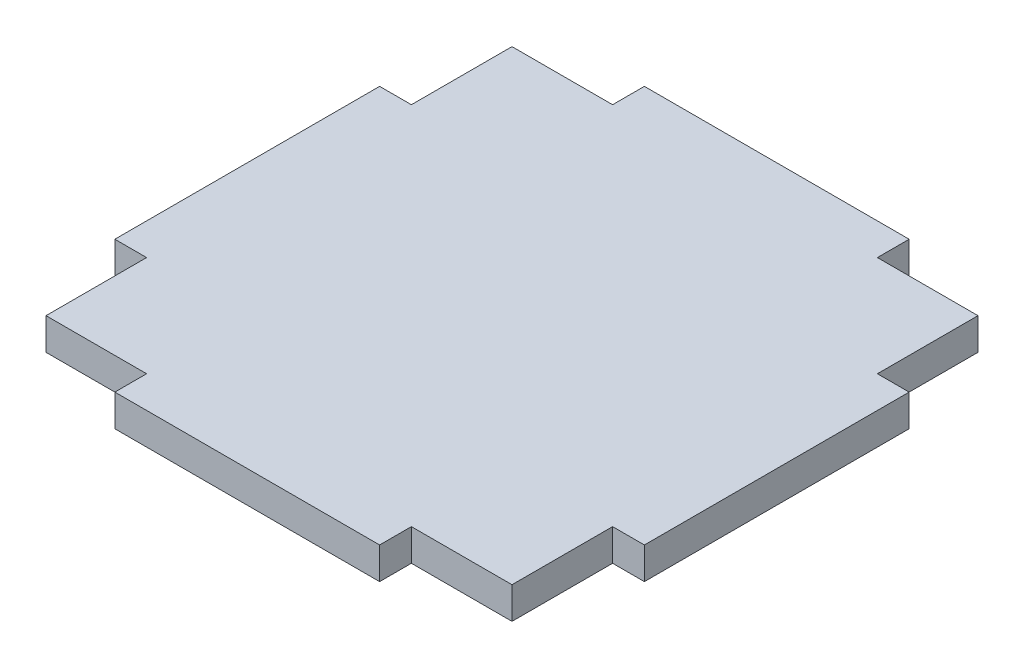
from build123d import *

# Parameters (mm, degrees)
ESQUISSE1_W             = 50
ESQUISSE1_H             = 50
BOSS_EXTRU_1_DEPTH      = 3
ENL_V_MAT_EXTRU_1_DEPTH = 3


with BuildPart() as part:
    # Esquisse1 → Boss.-Extru.1 (new body)
    with BuildSketch(Plane(origin=(0, 0, 0), x_dir=(1, 0, 0), z_dir=(0, 1, 0))):
        with Locations((25, 25)):
            Rectangle(ESQUISSE1_W, ESQUISSE1_H)
    extrude(amount=BOSS_EXTRU_1_DEPTH)

    # Esquisse2 → Enlèv. mat.-Extru.1 (cut)
    with BuildSketch(Plane(origin=(0, 3, 0), x_dir=(1, 0, 0), z_dir=(0, 1, 0))):
        Polygon((0, 37.5), (3, 37.5), (3, 47), (12.5, 47), (12.5, 50), (0, 50), align=None)
        Polygon((0, 12.5), (3, 12.5), (3, 3), (12.5, 3), (12.5, 0), (0, 0), align=None)
        Polygon((50, 12.5), (47, 12.5), (47, 3), (37.5, 3), (37.5, 0), (50, 0), align=None)
        Polygon((37.5, 50), (37.5, 47), (47, 47), (47, 37.5), (50, 37.5), (50, 50), align=None)
    extrude(amount=-ENL_V_MAT_EXTRU_1_DEPTH, mode=Mode.SUBTRACT)


solid = part.part
